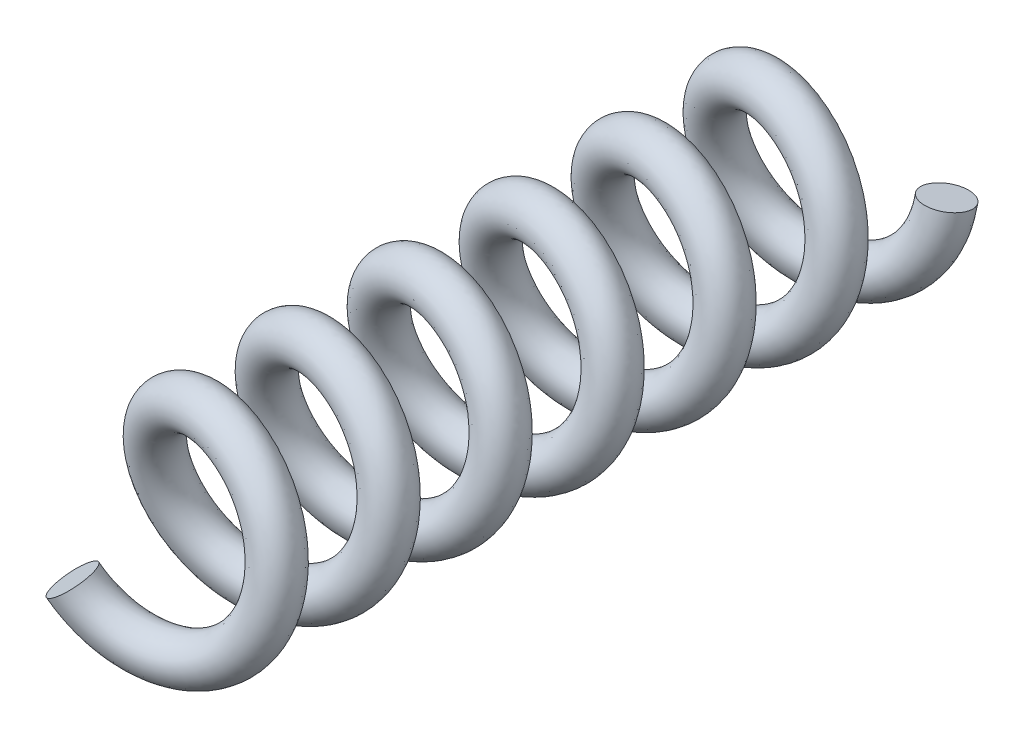
from build123d import *

# Parameters (mm, degrees)
SWEEP1_PITCH  = 5
SWEEP1_HEIGHT = 32
SWEEP1_RADIUS = 4
SKETCH5_R     = 1


with BuildPart() as part:
    # Sweep1: sweep along a helix
    with BuildLine() as sweep1_path:
        Helix(SWEEP1_PITCH, SWEEP1_HEIGHT, SWEEP1_RADIUS, center=(0, 0, 0), direction=(0, 0, 1), lefthand=True)
    # Sketch5 → Sweep1 (sweep)
    with BuildSketch(Plane(origin=(4, 0, 0), x_dir=(-1, 0, 0), z_dir=(0, -0.9807794039193418, 0.19511986277060697))):
        with Locations((0.111305282, 0)):
            Circle(SKETCH5_R)
    sweep(path=sweep1_path.line, is_frenet=True)


solid = part.part
